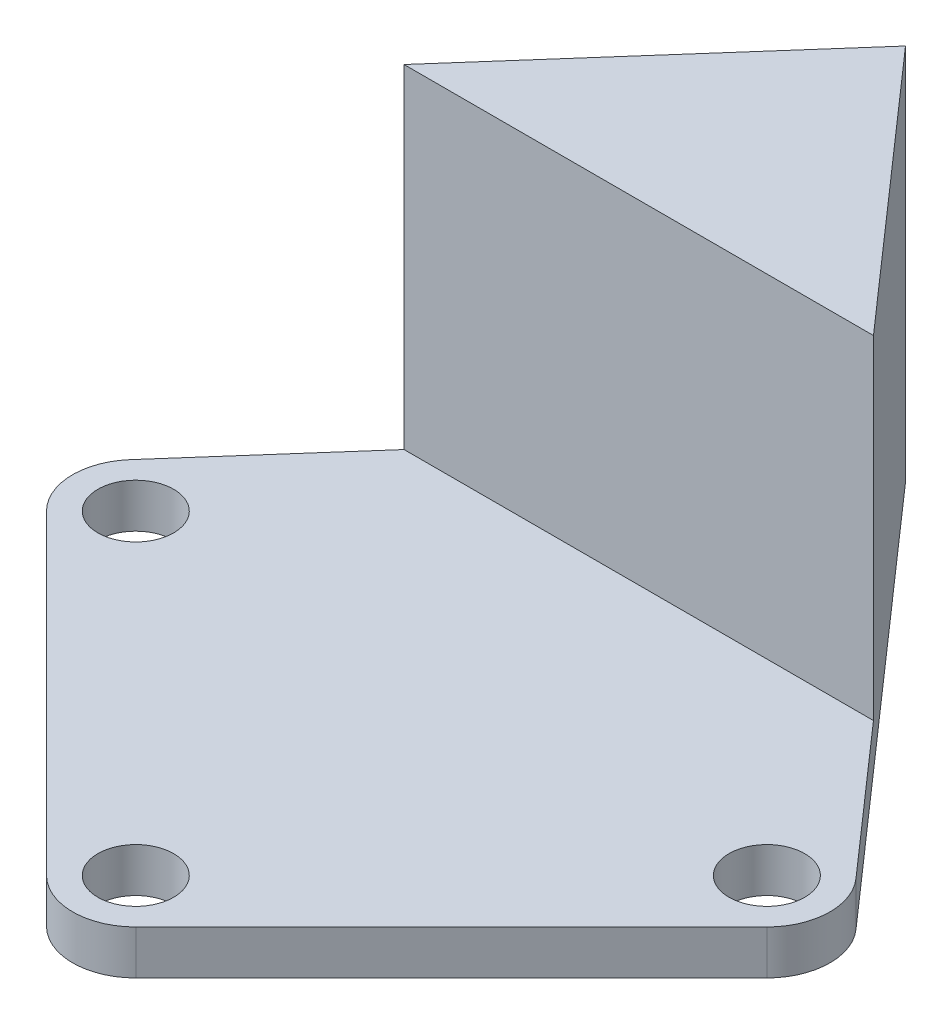
from build123d import *

# Parameters (mm, degrees)
SKETCH1_R           = 3
BOSS_EXTRUDE1_DEPTH = 3.5
BOSS_EXTRUDE2_DEPTH = 29.918114598
CUT_EXTRUDE1_START  = -3.5
CUT_EXTRUDE1_DEPTH  = 28.5


with BuildPart() as part:
    # Sketch1 → Boss-Extrude1 (new body)
    with BuildSketch(Plane(origin=(0, 0, 0), x_dir=(1, 0, 0), z_dir=(0, 1, 0))):
        with BuildLine():
            ThreePointArc((-28.753774302, 3.302904553), (-29.997455721, -0.159487685), (-28.535533906, -3.535533906))
            Line((-28.535533906, -3.535533906), (-3.535533906, -28.535533906))
            ThreePointArc((-3.535533906, -28.535533906), (0, -30), (3.535533906, -28.535533906))
            Line((3.535533906, -28.535533906), (28.535533906, -3.535533906))
            ThreePointArc((28.535533906, -3.535533906), (29.997455721, -0.159487685), (28.753774302, 3.302904553))
            Line((28.753774302, 3.302904553), (0, 35.98177169))
            Line((0, 35.98177169), (-28.753774302, 3.302904553))
        make_face()
        with Locations((25, 0)):
            Circle(SKETCH1_R, mode=Mode.SUBTRACT)
        with Locations((0, -25)):
            Circle(SKETCH1_R, mode=Mode.SUBTRACT)
        with Locations((-25, 0)):
            Circle(SKETCH1_R, mode=Mode.SUBTRACT)
    extrude(amount=BOSS_EXTRUDE1_DEPTH)

    # Sketch1<3> → Boss-Extrude2 (add)
    with BuildSketch(Plane(origin=(0, 0, 0), x_dir=(1, 0, 0), z_dir=(0, 1, 0))):
        Polygon((0, 35.98177169), (-18.594331138, 14.849183308), (18.594331138, 14.849183308), align=None)
    extrude(amount=BOSS_EXTRUDE2_DEPTH)

    # Sketch3 → Cut-Extrude1 (cut)
    with BuildSketch(Plane(origin=(0, 29.918114598, 0), x_dir=(1, 0, 0), z_dir=(0, 1, 0)).offset(CUT_EXTRUDE1_START)):
        Polygon((11.958686143, 17.849183308), (0, 31.440314389), (-11.958686143, 17.849183308), align=None)
    extrude(amount=-CUT_EXTRUDE1_DEPTH, mode=Mode.SUBTRACT)


solid = part.part
